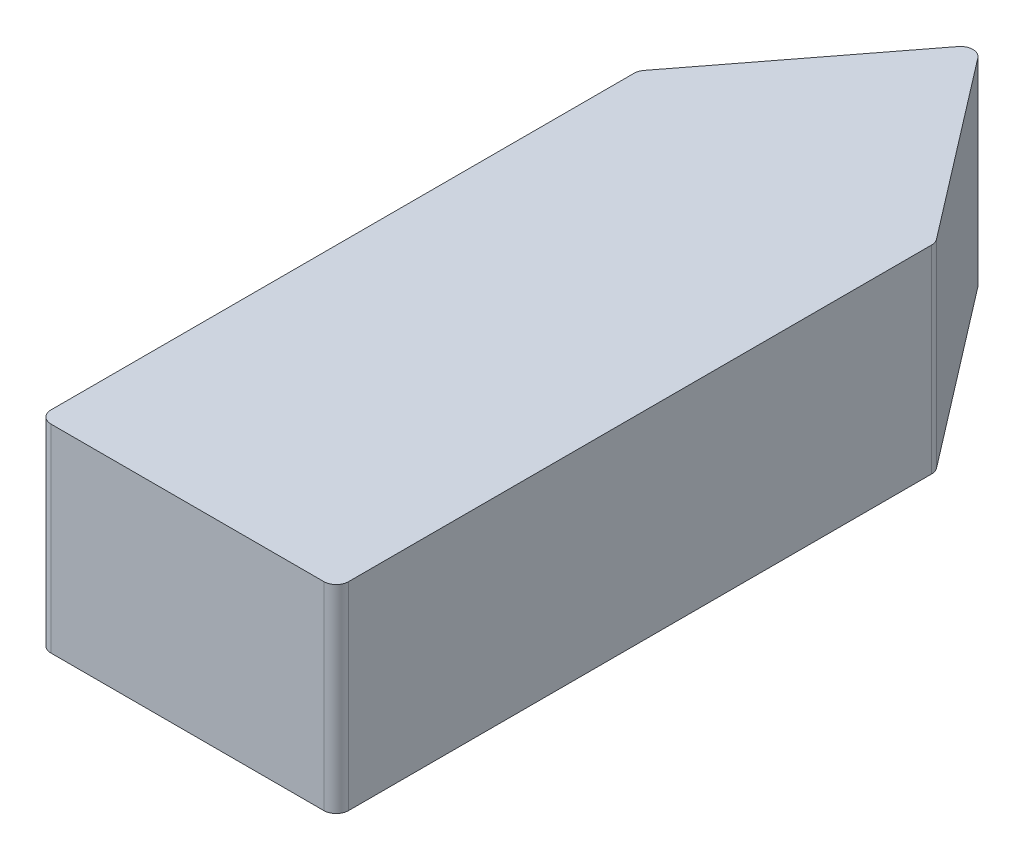
from build123d import *

# Parameters (mm, degrees)
EXTRUDE1_DEPTH = 25.4


with BuildPart() as part:
    # Sketch1 → Extrude1 (new body)
    with BuildSketch(Plane(origin=(0, 0, 0), x_dir=(1, 0, 0), z_dir=(0, 1, 0))):
        with BuildLine():
            Line((-17.4625, 0), (17.4625, 0))
            ThreePointArc((17.4625, 0), (18.585032015, 0.464967985), (19.05, 1.5875))
            Line((19.05, 1.5875), (19.05, 76.234673011))
            ThreePointArc((19.05, 76.234673011), (18.965751581, 76.744958163), (18.721948428, 77.20108178))
            Line((18.721948428, 77.20108178), (1.259448428, 99.958654853))
            ThreePointArc((1.259448428, 99.958654853), (0, 100.579746085), (-1.259448428, 99.958654853))
            Line((-1.259448428, 99.958654853), (-18.721948428, 77.20108178))
            ThreePointArc((-18.721948428, 77.20108178), (-18.965751581, 76.744958163), (-19.05, 76.234673011))
            Line((-19.05, 76.234673011), (-19.05, 1.5875))
            ThreePointArc((-19.05, 1.5875), (-18.585032015, 0.464967985), (-17.4625, 0))
        make_face()
    extrude(amount=EXTRUDE1_DEPTH)


solid = part.part
